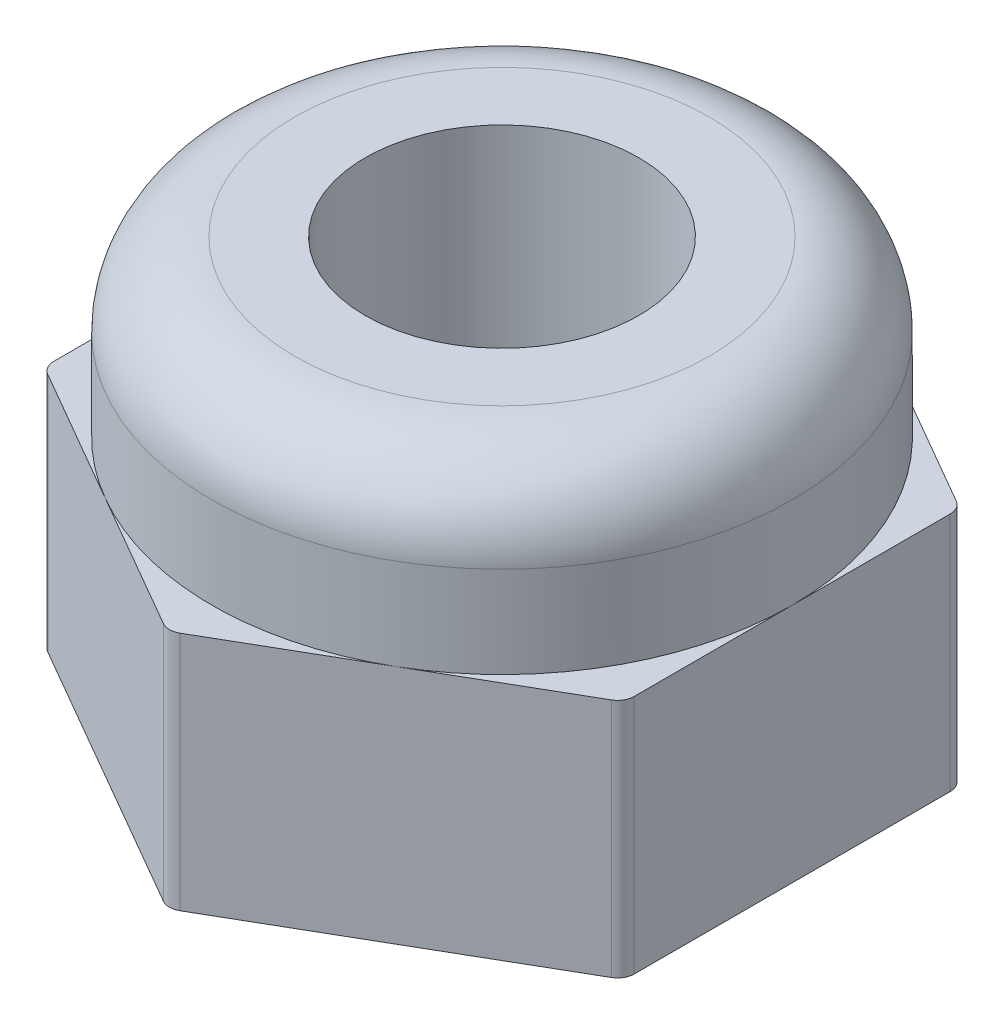
from build123d import *

# Parameters (mm, degrees)
EXTRUDE_1_DEPTH        = 2.9
SKETCH_2_R             = 3.5
EXTRUDE_2_DEPTH        = 5
FILLET_2_R             = 1
FILLET_3_R             = 0.2
HOLE_WIZARD_M4_1_D     = 3.3
HOLE_WIZARD_M4_1_DEPTH = 10.1
HOLE_WIZARD_M4_1_TIP   = 0.991420021


with BuildPart() as part:
    # 草图1 → 凸台-拉伸1 (new body)
    with BuildSketch(Plane(origin=(0, 0, 0), x_dir=(1, 0, 0), z_dir=(0, 1, 0))):
        Polygon((3.5, -2.020725942), (3.5, 2.020725942), (0, 4.041451884), (-3.5, 2.020725942), (-3.5, -2.020725942), (0, -4.041451884), align=None)
    extrude(amount=EXTRUDE_1_DEPTH)

    # 草图2 → 凸台-拉伸2 (add)
    with BuildSketch(Plane(origin=(0, 0, 0), x_dir=(-1, 0, 0), z_dir=(0, -1, 0))):
        with Locations(Location((0, 0, 0), (0, 0, 90))):
            Circle(SKETCH_2_R)
    extrude(amount=-EXTRUDE_2_DEPTH)

    # 圆角2
    fillet_2_edges = [part.edges().sort_by_distance(p)[0] for p in [
        (0, 5, 3.5),
    ]]
    fillet(fillet_2_edges, radius=FILLET_2_R)

    # 圆角3
    fillet_3_edges = [part.edges().sort_by_distance(p)[0] for p in [
        (0, 1.45, 4.041451884),
        (-3.5, 1.45, 2.020725942),
        (-3.5, 1.45, -2.020725942),
        (0, 1.45, -4.041451884),
        (3.5, 1.45, -2.020725942),
        (3.5, 1.45, 2.020725942),
    ]]
    fillet(fillet_3_edges, radius=FILLET_3_R)

    # M4 螺纹孔1
    with Locations(Plane(origin=(0, 0, 0), x_dir=(-1, 0, 0), z_dir=(0, -1, 0))):
        with Locations((0, 0)):
            Hole(HOLE_WIZARD_M4_1_D / 2, depth=HOLE_WIZARD_M4_1_DEPTH)
            with Locations((0, 0, -(HOLE_WIZARD_M4_1_DEPTH + HOLE_WIZARD_M4_1_TIP / 2))):  # 118° drill point
                Cone(0, HOLE_WIZARD_M4_1_D / 2, HOLE_WIZARD_M4_1_TIP, mode=Mode.SUBTRACT)


solid = part.part
